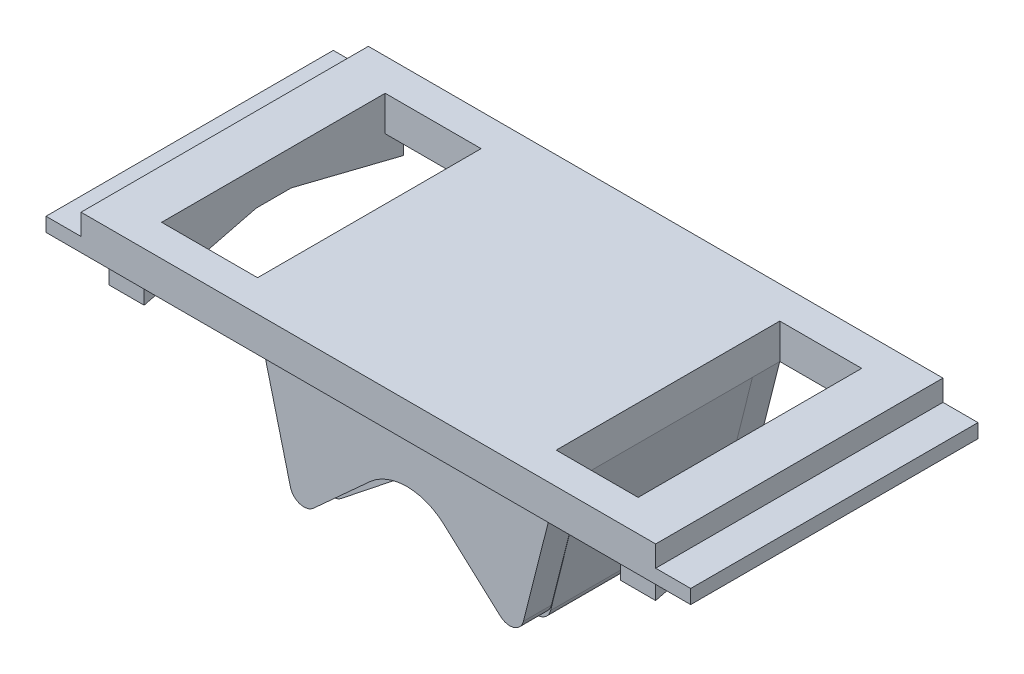
from build123d import *

# Parameters (mm, degrees)
SKETCH_1_W                = 75.557626564
SKETCH_1_H                = 3.901331086
EXTRUDE_1_DEPTH           = 25
SKETCH_1_H_2              = 4
EXTRUDE_1_2_DEPTH         = 25
CUT_EXTRUDE_15_DEPTH      = 32
SKETCH_1_6_W              = 75.557626564
SKETCH_1_6_H              = 24
EXTRUDE_5_DEPTH           = 25
CUT_EXTRUDE_16_DEPTH      = 153.500220667
CUT_EXTRUDE_16_DEPTH_BACK = 153.500220667
FILLET_2_R                = 2
FILLET_3_R                = 2
EXTRUDE_6_DEPTH           = 5
EXTRUDE_6_2_DEPTH         = 5
EXTRUDE_7_DEPTH           = 5
EXTRUDE_7_2_DEPTH         = 5
SKETCH_6_W                = 82
SKETCH_6_H                = 41
SKETCH_6_W_2              = 13.693142479
SKETCH_6_H_2              = 31.901331086
SKETCH_6_W_3              = 11.689861707
EXTRUDE_8_DEPTH           = 5
SKETCH_7_W                = 5
SKETCH_7_H                = 41
EXTRUDE_9_DEPTH           = 2
CUT_EXTRUDE_17_DEPTH      = 163.242088223
CUT_EXTRUDE_17_DEPTH_BACK = 163.242088223


with BuildPart() as part:
    # Эскиз1 → Бобышка-Вытянуть1 (new body)
    with BuildSketch(Plane(origin=(0, 102.001425994, 0), x_dir=(1, 0, 0), z_dir=(0, 1, 0))):
        with Locations((68.52058233, -72.602036932)):
            Rectangle(SKETCH_1_W, SKETCH_1_H)
    extrude(amount=-EXTRUDE_1_DEPTH)


with BuildPart() as body_2:
    # Эскиз1 → Extrude 1 2 (new body)
    with BuildSketch(Plane(origin=(0, 102.001425994, 0), x_dir=(1, 0, 0), z_dir=(0, 1, 0))):
        with Locations((68.52058233, -100.552702475)):
            Rectangle(SKETCH_1_W, SKETCH_1_H_2)
    extrude(amount=-EXTRUDE_1_2_DEPTH)


with BuildPart() as cut_extrude_15_tool:
    # Эскиз2 → Вырез-Вытянуть15 (new body)
    with BuildSketch(Plane.XY.offset(102.552702475)):
        with BuildLine():
            Line((63.510266919, 89.850934142), (52.937126115, 80.258094246))
            Line((52.937126115, 80.258094246), (47.434911527, 102.001425994))
            Line((47.434911527, 102.001425994), (30.741769048, 102.001425994))
            Line((30.741769048, 102.001425994), (30.741769048, 77.001425994))
            Line((30.741769048, 77.001425994), (106.299395612, 77.001425994))
            Line((106.299395612, 77.001425994), (106.299395612, 102.001425994))
            Line((106.299395612, 102.001425994), (90.051907341, 102.001425994))
            Line((90.051907341, 102.001425994), (84.547557962, 80.262935973))
            Line((84.547557962, 80.262935973), (73.973273177, 89.850934142))
            ThreePointArc((73.973273177, 89.850934142), (68.741770048, 91.84906096), (63.510266919, 89.850934142))
        make_face()
    extrude(amount=-CUT_EXTRUDE_15_DEPTH)


with BuildPart() as part_1:
    add(part.part)

    # Вырез-Вытянуть15: cut by cut_extrude_15_tool
    add(cut_extrude_15_tool.part, mode=Mode.SUBTRACT)



with BuildPart() as body_2_1:
    add(body_2.part)

    # Вырез-Вытянуть15: cut by cut_extrude_15_tool
    add(cut_extrude_15_tool.part, mode=Mode.SUBTRACT)


with BuildPart() as part_2:
    add(part_1.part)

    add(body_2_1.part)  # Бобышка-Вытянуть5 merges body 2
    # Эскиз1<6> → Бобышка-Вытянуть5 (add)
    with BuildSketch(Plane(origin=(0, 102.001425994, 0), x_dir=(1, 0, 0), z_dir=(0, 1, 0))):
        with Locations((68.52058233, -86.552702475)):
            Rectangle(SKETCH_1_6_W, SKETCH_1_6_H)
    extrude(amount=-EXTRUDE_5_DEPTH)

    # Эскиз3 → Вырез-Вытянуть16 (cut, two sides: drawn at the far end of the back side and taken through both)
    with BuildSketch(Plane.XY.offset(110.052702475).offset(-CUT_EXTRUDE_16_DEPTH_BACK)):
        with BuildLine():
            Line((52.937126115, 79.748220071), (47.431470764, 102.001425994))
            Line((47.431470764, 102.001425994), (30.73376132, 102.001425994))
            Line((30.73376132, 102.001425994), (30.741769048, 77.001425994))
            Line((30.741769048, 77.001425994), (88.549097609, 77.001425994))
            ThreePointArc((88.549097609, 77.001425994), (93.741770048, 86.149059032), (98.934442488, 77.001425994))
            Line((98.934442488, 77.001425994), (106.299395612, 77.001425994))
            Line((106.299395612, 77.001425994), (106.299395612, 102.001425994))
            Line((106.299395612, 102.001425994), (90.051907341, 102.001425994))
            Line((90.051907341, 102.001425994), (84.489905965, 79.748220071))
            Line((84.489905965, 79.748220071), (72.796657252, 89.081573622))
            ThreePointArc((72.796657252, 89.081573622), (68.741770048, 90.501426994), (64.686882844, 89.081573622))
            Line((64.686882844, 89.081573622), (52.937126115, 79.748220071))
        make_face()
    extrude(amount=CUT_EXTRUDE_16_DEPTH + CUT_EXTRUDE_16_DEPTH_BACK, mode=Mode.SUBTRACT)


with BuildPart() as cut_extrude_16_piece_1:
    # of the separate pieces the step leaves, piece 1, a body of its own (cut_extrude_16_pieces)
    add(part_2.part.solids().sort_by_distance((90.051907341, 102.001425994, 74.552702475))[0])

    # Скругление2
    fillet_2_edges = [cut_extrude_16_piece_1.edges().sort_by_distance(p)[0] for p in [
        (52.937126115, 80.258094246, 100.552702475),
        (52.937126115, 80.258094246, 72.602036932),
        (84.547557962, 80.262935973, 100.552702475),
        (84.547557962, 80.262935973, 72.602036932),
    ]]
    fillet(fillet_2_edges, radius=FILLET_2_R)

    # Скругление3
    fillet_3_edges = [cut_extrude_16_piece_1.edges().sort_by_distance(p)[0] for p in [
        (84.489905965, 79.748220071, 86.552702475),
        (52.937126115, 79.748220071, 86.552702475),
    ]]
    fillet(fillet_3_edges, radius=FILLET_3_R)



with BuildPart() as cut_extrude_16_piece_2:
    # of the separate pieces the step leaves, piece 2, a body of its own (cut_extrude_16_pieces)
    add(part_2.part.solids().sort_by_distance((88.549097609, 77.001425994, 74.552702475))[0])

    # Эскиз3<3> → Вырез-Вытянуть17 (cut, two sides: drawn at the far end of the back side and taken through both)
    with BuildSketch(Plane.XY.offset(110.052702475).offset(-CUT_EXTRUDE_17_DEPTH_BACK)):
        with BuildLine():
            ThreePointArc((99.789402086, 80.101426994), (92.13390173, 85.931402357), (88.549097609, 77.001425994))
            Line((88.549097609, 77.001425994), (98.934442488, 77.001425994))
            ThreePointArc((98.934442488, 77.001425994), (99.571745411, 78.493558676), (99.789402086, 80.101426994))
        make_face()
    extrude(amount=CUT_EXTRUDE_17_DEPTH + CUT_EXTRUDE_17_DEPTH_BACK, mode=Mode.SUBTRACT)


with BuildPart() as body_3:
    # Эскиз4 → Бобышка-Вытянуть6 (new body)
    with BuildSketch(Plane(origin=(28.741769048, 0, 0), x_dir=(0, 0, -1), z_dir=(1, 0, 0))):
        Polygon((-105.052702475, 102.001425994), (-105.052702475, 98.001425994), (-89.052702475, 102.001425994), align=None)
    extrude(amount=EXTRUDE_6_DEPTH)


with BuildPart() as body_4:
    # Эскиз4 → Extrude 6 2 (new body)
    with BuildSketch(Plane(origin=(28.741769048, 0, 0), x_dir=(0, 0, -1), z_dir=(1, 0, 0))):
        Polygon((-68.052702475, 102.001425994), (-68.052702475, 98.001425994), (-84.052702475, 102.001425994), align=None)
    extrude(amount=EXTRUDE_6_2_DEPTH)


with BuildPart() as body_5:
    # Эскиз5 → Бобышка-Вытянуть7 (new body)
    with BuildSketch(Plane.ZY.offset(-106.741769048)):
        Polygon((105.052702475, 102.001425994), (105.052702475, 98.001425994), (89.052702475, 102.001425994), align=None)
    extrude(amount=EXTRUDE_7_DEPTH)


with BuildPart() as body_6:
    # Эскиз5 → Extrude 7 2 (new body)
    with BuildSketch(Plane.ZY.offset(-106.741769048)):
        Polygon((68.052702475, 102.001425994), (84.052702475, 102.001425994), (68.052702475, 98.001425994), align=None)
    extrude(amount=EXTRUDE_7_2_DEPTH)


with BuildPart() as cut_extrude_16_piece_1_1:
    add(cut_extrude_16_piece_1.part)

    add(body_3.part)  # Бобышка-Вытянуть8 merges body 3

    add(body_4.part)  # Бобышка-Вытянуть8 merges body 4

    add(body_5.part)  # Бобышка-Вытянуть8 merges body 5

    add(body_6.part)  # Бобышка-Вытянуть8 merges body 6
    # Эскиз6 → Бобышка-Вытянуть8 (add)
    with BuildSketch(Plane(origin=(0, 102.001425994, 0), x_dir=(1, 0, 0), z_dir=(0, 1, 0))):
        with Locations((67.741769048, -86.552702475)):
            Rectangle(SKETCH_6_W, SKETCH_6_H)
        with Locations((40.588340288, -86.602036932)):
            Rectangle(SKETCH_6_W_2, SKETCH_6_H_2, mode=Mode.SUBTRACT)
        with Locations((95.896838195, -86.602036932)):
            Rectangle(SKETCH_6_W_3, SKETCH_6_H_2, mode=Mode.SUBTRACT)
    extrude(amount=EXTRUDE_8_DEPTH)

    # Эскиз7 → Бобышка-Вытянуть9 (add)
    with BuildSketch(Plane(origin=(0, 102.001425994, 0), x_dir=(1, 0, 0), z_dir=(0, 1, 0))):
        with Locations((24.241769048, -86.552702475)):
            Rectangle(SKETCH_7_W, SKETCH_7_H)
        with Locations((111.241769048, -86.552702475)):
            Rectangle(SKETCH_7_W, SKETCH_7_H)
    extrude(amount=EXTRUDE_9_DEPTH)


solid = cut_extrude_16_piece_1_1.part
